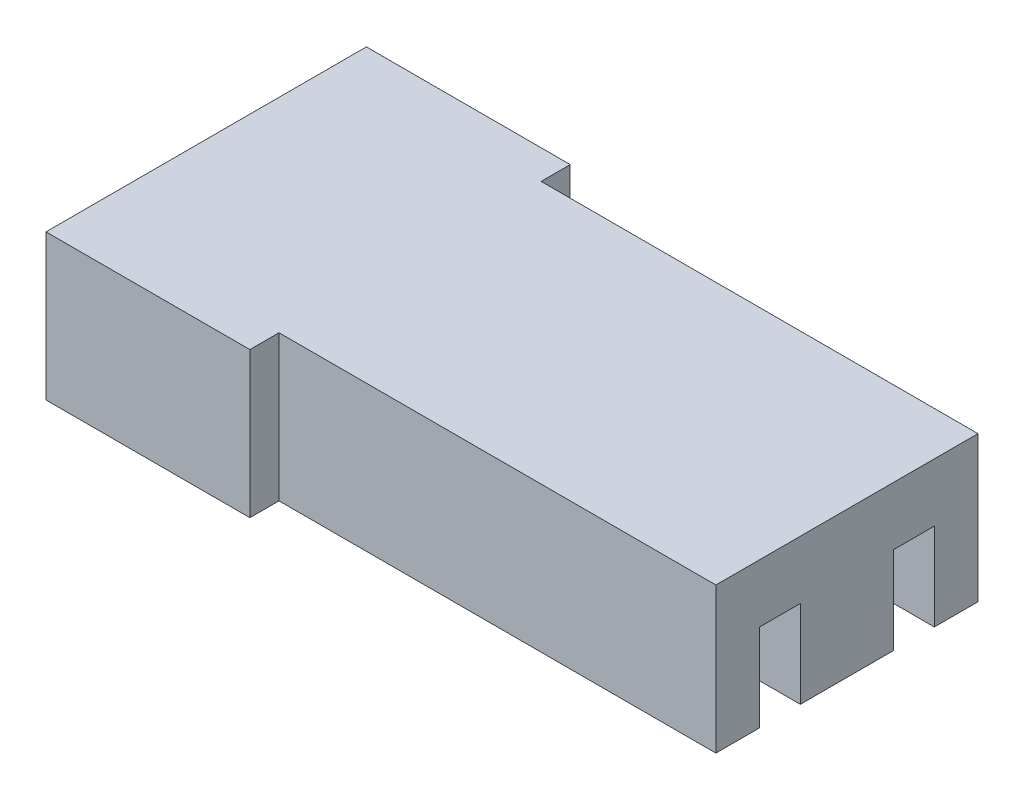
from build123d import *

# Parameters (mm, degrees)
BOSS_EXTRUDE1_DEPTH = 2
SKETCH2_W           = 7
SKETCH2_H           = 3.2
BOSS_EXTRUDE2_DEPTH = 3
SKETCH3_W           = 7
SKETCH3_H           = 3.108863517
BOSS_EXTRUDE3_DEPTH = 2


with BuildPart() as part:
    # Sketch1 → Boss-Extrude1 (new body)
    with BuildSketch(Plane(origin=(0, 0, 0), x_dir=(1, 0, 0), z_dir=(0, 1, 0))):
        Polygon((-7.5, -4.5), (7.5, -4.5), (7.5, 4.5), (-7.5, 4.5), (-7.5, 5.5), (-14.5, 5.5), (-14.5, -5.5), (-7.5, -5.5), align=None)
    extrude(amount=BOSS_EXTRUDE1_DEPTH)

    # Sketch2 → Boss-Extrude2 (add)
    with BuildSketch(Plane(origin=(0, 0, 0), x_dir=(1, 0, 0), z_dir=(0, 1, 0))):
        Polygon((7.5, 4.5), (-7.5, 4.5), (-7.5, 5.5), (-14.5, 5.5), (-14.5, 3.5), (0.5, 3.5), (0.5, 3), (7.5, 3), align=None)
        Polygon((7.5, -4.5), (-7.5, -4.5), (-7.5, -5.5), (-14.5, -5.5), (-14.5, -3.5), (0.5, -3.5), (0.5, -3), (7.5, -3), align=None)
        with Locations((4, 0)):
            Rectangle(SKETCH2_W, SKETCH2_H)
    extrude(amount=-BOSS_EXTRUDE2_DEPTH)

    # Sketch3 → Boss-Extrude3 (add)
    with BuildSketch(Plane.XZ.offset(3)):
        with Locations((-11, 3.945568242)):
            Rectangle(SKETCH3_W, SKETCH3_H)
        with Locations((-11, -3.945568242)):
            Rectangle(SKETCH3_W, SKETCH3_H)
    extrude(amount=-BOSS_EXTRUDE3_DEPTH)


solid = part.part
